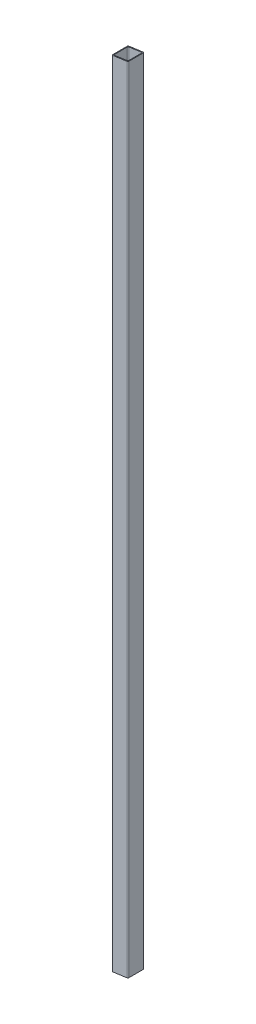
from build123d import *

# Parameters (mm, degrees)
BOSS_EXTRUDE1_DEPTH = 4950
CUT_EXTRUDE1_DEPTH  = 1000


with BuildPart() as part:
    # Sketch1 → Boss-Extrude1 (new body)
    with BuildSketch(Plane(origin=(0, 0, 0), x_dir=(1, 0, 0), z_dir=(0, 1, 0))):
        with BuildLine():
            Line((5, 0), (95, 0))
            ThreePointArc((95, 0), (98.535533906, -1.464466094), (100, -5))
            Line((100, -5), (100, -95))
            ThreePointArc((100, -95), (98.535533906, -98.535533906), (95, -100))
            Line((95, -100), (5, -100))
            ThreePointArc((5, -100), (1.464466094, -98.535533906), (0, -95))
            Line((0, -95), (0, -5))
            ThreePointArc((0, -5), (1.464466094, -1.464466094), (5, 0))
        make_face()
        with BuildLine():
            Line((10, -5), (90, -5))
            ThreePointArc((90, -5), (93.535533906, -6.464466094), (95, -10))
            Line((95, -10), (95, -90))
            ThreePointArc((95, -90), (93.535533906, -93.535533906), (90, -95))
            Line((90, -95), (10, -95))
            ThreePointArc((10, -95), (6.464466094, -93.535533906), (5, -90))
            Line((5, -90), (5, -10))
            ThreePointArc((5, -10), (6.464466094, -6.464466094), (10, -5))
        make_face(mode=Mode.SUBTRACT)
    extrude(amount=BOSS_EXTRUDE1_DEPTH)

    # Sketch2 → Cut-Extrude1 (cut)
    with BuildSketch(Plane(origin=(0, 0, 0), x_dir=(-1, 0, 0), z_dir=(0, 0, -1))):
        Polygon((-95, 4950), (-95, 4949.297295826), (-5, 4936.648620703), (-5, 4950), align=None)
        Polygon((-5, 4936.648620703), (0, 4935.94591653), (0, 4950), (-5, 4950), align=None)
        Polygon((-100, 4950), (-95, 4949.297295826), (-95, 4950), align=None)
        Polygon((-100, 0), (-100, 14.05408347), (0, 0), align=None)
    extrude(amount=-CUT_EXTRUDE1_DEPTH, mode=Mode.SUBTRACT)


solid = part.part
